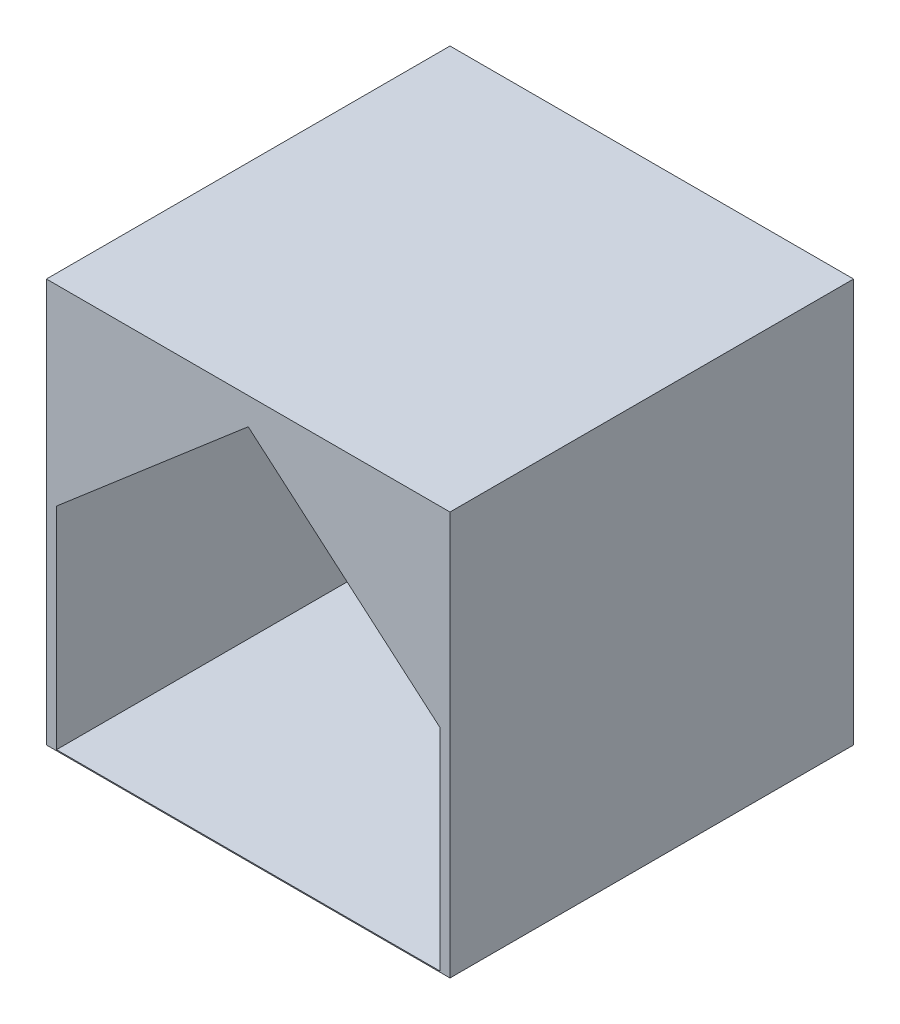
from build123d import *

# Parameters (mm, degrees)
SKETCH1_W               = 2000
SKETCH1_H               = 2000
BOSS_EXTRUDE1_DEPTH     = 2000
CUT_EXTRUDE4_DEPTH      = 2450.489742783
CUT_EXTRUDE4_DEPTH_BACK = 1995
SKETCH6_R               = 100
CUT_EXTRUDE5_DEPTH      = 20
SKETCH3_R               = 100
CUT_EXTRUDE6_DEPTH      = 20


with BuildPart() as part:
    # Sketch1 → Boss-Extrude1 (new body)
    with BuildSketch(Plane.XY):
        Rectangle(SKETCH1_W, SKETCH1_H)
    extrude(amount=BOSS_EXTRUDE1_DEPTH)

    # Sketch2 → Cut-Extrude4 (cut, two sides: drawn at the far end of the back side and taken through both)
    with BuildSketch(Plane.XY.offset(2000).offset(-CUT_EXTRUDE4_DEPTH_BACK)):
        Polygon((-950, -995), (-950, 50.500700421), (0, 865.900952839), (950, 50.500700421), (950, -995), align=None)
    extrude(amount=CUT_EXTRUDE4_DEPTH + CUT_EXTRUDE4_DEPTH_BACK, mode=Mode.SUBTRACT)

    # Sketch6 → Cut-Extrude5 (cut)
    with BuildSketch(Plane(origin=(427.946064097, 498.587975275, 0), x_dir=(0.7588165446031105, -0.6513044231667675, 0), z_dir=(-0.6513044231667675, -0.7588165446031105, 0))):
        with Locations((62.009633604, 1500)):
            Circle(SKETCH6_R)
        with Locations((62.009633604, 1002.5)):
            Circle(SKETCH6_R)
        with Locations((62.009633604, 502.5)):
            Circle(SKETCH6_R)
    extrude(amount=-CUT_EXTRUDE5_DEPTH, mode=Mode.SUBTRACT)

    # Sketch3 → Cut-Extrude6 (cut)
    with BuildSketch(Plane(origin=(-427.946064097, 498.587975275, 0), x_dir=(0.7588165446031103, 0.6513044231667675, 0), z_dir=(0.6513044231667675, -0.7588165446031103, 0))):
        with Locations((-62.009633604, 1500)):
            Circle(SKETCH3_R)
        with Locations((-62.009633604, 1000)):
            Circle(SKETCH3_R)
        with Locations((-62.009633604, 502.5)):
            Circle(SKETCH3_R)
    extrude(amount=-CUT_EXTRUDE6_DEPTH, mode=Mode.SUBTRACT)


solid = part.part
